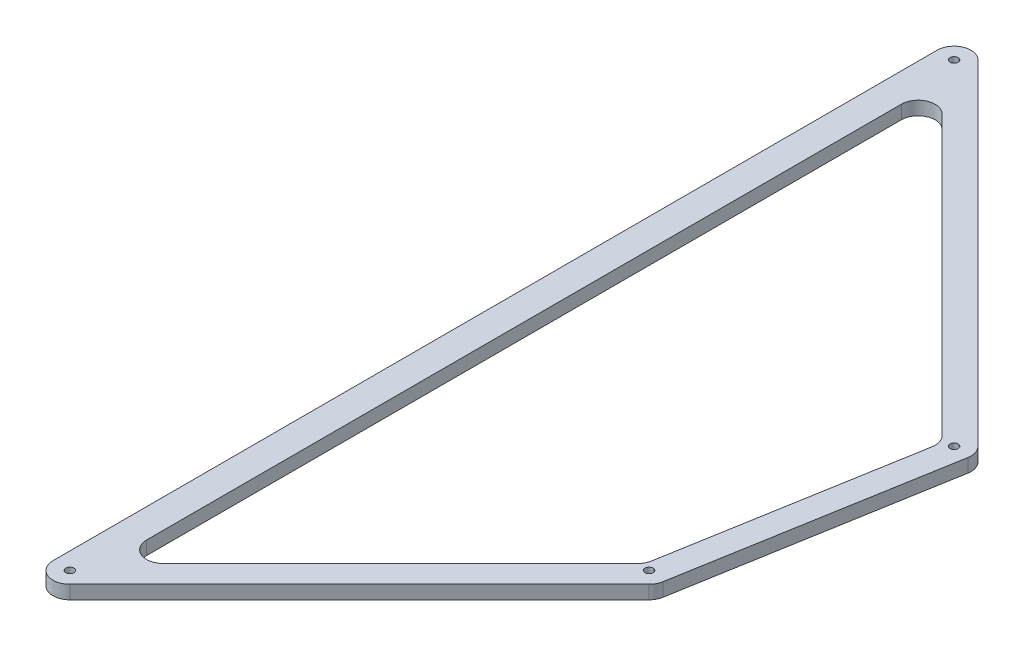
from build123d import *

# Parameters (mm, degrees)
SKETCH1_R           = 0.762
BOSS_EXTRUDE1_DEPTH = 2.54


with BuildPart() as part:
    # Sketch1 → Boss-Extrude1 (new body)
    with BuildSketch(Plane(origin=(0, 0, 0), x_dir=(1, 0, 0), z_dir=(0, 1, 0))):
        with BuildLine():
            Line((2.24506403, 168.20866403), (65.044442945, 105.409285116))
            ThreePointArc((65.044442945, 105.409285116), (65.825857867, 104.123934663), (65.927937921, 102.623163284))
            Line((65.927937921, 102.623163284), (57.487473144, 53.817856336))
            ThreePointArc((57.487473144, 53.817856336), (57.177577906, 52.897490325), (56.603978168, 52.113850107))
            Line((56.603978168, 52.113850107), (2.24506403, -2.24506403))
            ThreePointArc((2.24506403, -2.24506403), (-1.215019898, -2.933317516), (-3.175, 0))
            Line((-3.175, 0), (-3.175, 165.9636))
            ThreePointArc((-3.175, 165.9636), (-1.215019898, 168.896917516), (2.24506403, 168.20866403))
        make_face()
        with Locations(Location((0, 0, 0), (0, 0, 270))):
            Circle(SKETCH1_R, mode=Mode.SUBTRACT)
        with Locations(Location((54.358914138, 54.358914138, 0), (0, 0, 270))):
            Circle(SKETCH1_R, mode=Mode.SUBTRACT)
        with Locations(Location((62.799378914, 103.164221086, 0), (0, 0, 270))):
            Circle(SKETCH1_R, mode=Mode.SUBTRACT)
        with Locations(Location((0, 165.9636, 0), (0, 0, 270))):
            Circle(SKETCH1_R, mode=Mode.SUBTRACT)
        with BuildLine():
            Line((2.24506403, 153.808343879), (2.24506403, 12.155256121))
            ThreePointArc((2.24506403, 12.155256121), (4.205044133, 9.221938605), (7.665128061, 9.910192091))
            Line((7.665128061, 9.910192091), (52.168498388, 54.413562418))
            ThreePointArc((52.168498388, 54.413562418), (52.742098126, 55.197202636), (53.051993364, 56.117568647))
            Line((53.051993364, 56.117568647), (60.814307068, 101.001602046))
            ThreePointArc((60.814307068, 101.001602046), (60.712227014, 102.502373425), (59.930812092, 103.787723878))
            Line((59.930812092, 103.787723878), (7.665128061, 156.053407909))
            ThreePointArc((7.665128061, 156.053407909), (4.205044133, 156.741661395), (2.24506403, 153.808343879))
        make_face(mode=Mode.SUBTRACT)
    extrude(amount=BOSS_EXTRUDE1_DEPTH)


solid = part.part
